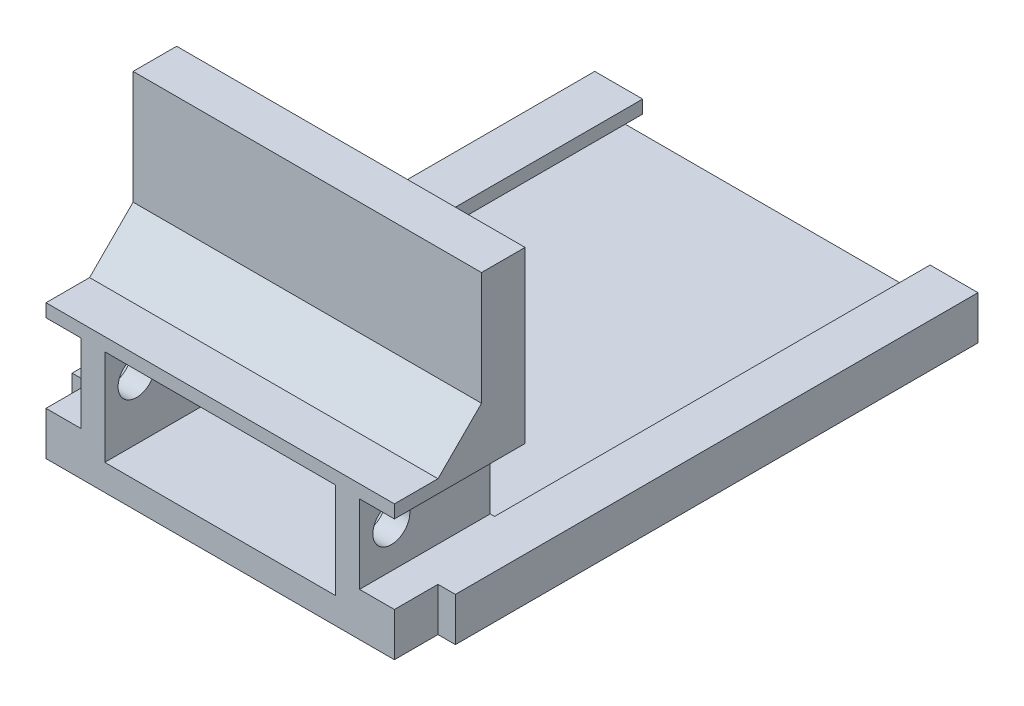
from build123d import *

# Parameters (mm, degrees)
BOSS_EXTRUDE1_DEPTH = 100
BOSS_EXTRUDE2_DEPTH = 20
SKETCH4_W           = 80
SKETCH4_H           = 31
BOSS_EXTRUDE3_DEPTH = 10
SKETCH4_2_W         = 80
SKETCH4_2_H         = 31
BOSS_EXTRUDE4_DEPTH = 20
SKETCH5_W           = 53
SKETCH5_H           = 22
SKETCH5_W_2         = 8
SKETCH5_H_2         = 18
CUT_EXTRUDE1_DEPTH  = 30
SKETCH6_W           = 10
SKETCH6_H           = 36
CUT_EXTRUDE2_DEPTH  = 80
SKETCH7_R           = 4.25
CUT_EXTRUDE3_DEPTH  = 162.012421881
CHAMFER1_SIZE       = 10


with BuildPart() as part:
    # Sketch1 → Boss-Extrude1 (new body)
    with BuildSketch(Plane.XY):
        Polygon((11, 0), (0, 0), (0, -10), (88, -10), (88, 0), (77, 0), (77, -3), (85, -3), (85, -7), (3, -7), (3, -3), (11, -3), align=None)
    extrude(amount=BOSS_EXTRUDE1_DEPTH)

    # Sketch2 → Boss-Extrude2 (add)
    with BuildSketch(Plane.XY.offset(100)):
        Polygon((77, 0), (11, 0), (11, -3), (3, -3), (3, -7), (85, -7), (85, -3), (77, -3), align=None)
        Polygon((4, 57), (4, 0), (11, 0), (77, 0), (84, 0), (84, 57), align=None)
        Polygon((0, 0), (0, -10), (88, -10), (88, 0), (84, 0), (77, 0), (77, -3), (85, -3), (85, -7), (3, -7), (3, -3), (11, -3), (11, 0), (4, 0), align=None)
    extrude(amount=BOSS_EXTRUDE2_DEPTH)

    # Sketch4 → Boss-Extrude3 (add)
    with BuildSketch(Plane.XY.offset(120)):
        with Locations((44, 5.5)):
            Rectangle(SKETCH4_W, SKETCH4_H)
    extrude(amount=BOSS_EXTRUDE3_DEPTH)

    # Sketch4<2> → Boss-Extrude4 (add)
    with BuildSketch(Plane.XY.offset(120)):
        with Locations((44, 5.5)):
            Rectangle(SKETCH4_2_W, SKETCH4_2_H)
    extrude(amount=-BOSS_EXTRUDE4_DEPTH)

    # Sketch5 → Cut-Extrude1 (cut)
    with BuildSketch(Plane.XY.offset(130)):
        with Locations((44, 7)):
            Rectangle(SKETCH5_W, SKETCH5_H)
        with Locations((8, 9)):
            Rectangle(SKETCH5_W_2, SKETCH5_H_2)
        with Locations((80, 9)):
            Rectangle(SKETCH5_W_2, SKETCH5_H_2)
    extrude(amount=-CUT_EXTRUDE1_DEPTH, mode=Mode.SUBTRACT)

    # Sketch6 → Cut-Extrude2 (cut)
    with BuildSketch(Plane.ZY.offset(-4)):
        with Locations((115, 39)):
            Rectangle(SKETCH6_W, SKETCH6_H)
    extrude(amount=-CUT_EXTRUDE2_DEPTH, mode=Mode.SUBTRACT)

    # Sketch7 → Cut-Extrude3 (cut, through all)
    with BuildSketch(Plane(origin=(76, 0, 0), x_dir=(0, 0, -1), z_dir=(1, 0, 0))):
        with Locations(Location((-122.7, 9.5, 0), (0, 0, 90))):
            Circle(SKETCH7_R)
    extrude(amount=-CUT_EXTRUDE3_DEPTH, mode=Mode.SUBTRACT)

    # Chamfer1
    chamfer1_edges = [part.edges().sort_by_distance(p)[0] for p in [
        (44, 21, 110),
    ]]
    chamfer(chamfer1_edges, length=CHAMFER1_SIZE)


solid = part.part
